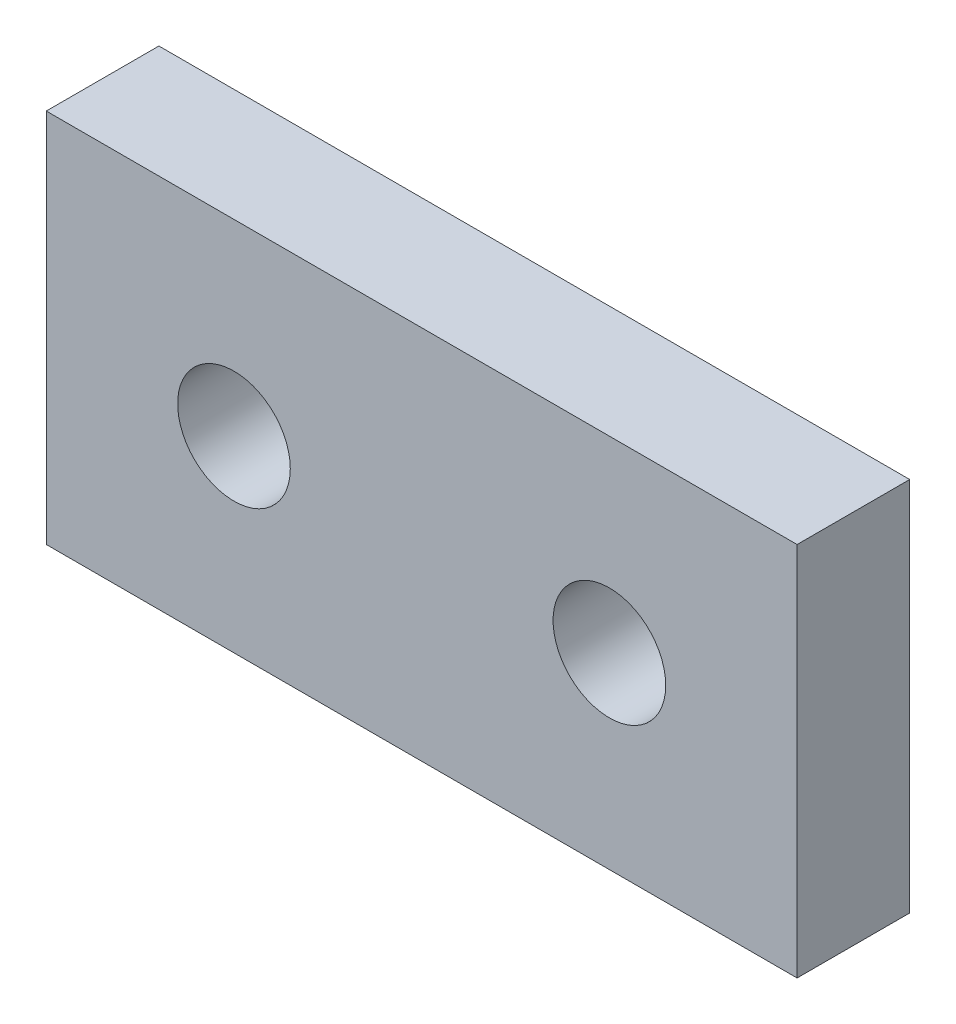
from build123d import *

# Parameters (mm, degrees)
SKETCH1_W           = 20
SKETCH1_H           = 10
SKETCH1_R           = 1.5
BOSS_EXTRUDE1_DEPTH = 3


with BuildPart() as part:
    # Sketch1 → Boss-Extrude1 (new body)
    with BuildSketch(Plane.XY):
        Rectangle(SKETCH1_W, SKETCH1_H)
        with Locations((-5, 0)):
            Circle(SKETCH1_R, mode=Mode.SUBTRACT)
        with Locations((5, 0)):
            Circle(SKETCH1_R, mode=Mode.SUBTRACT)
    extrude(amount=BOSS_EXTRUDE1_DEPTH)


solid = part.part
